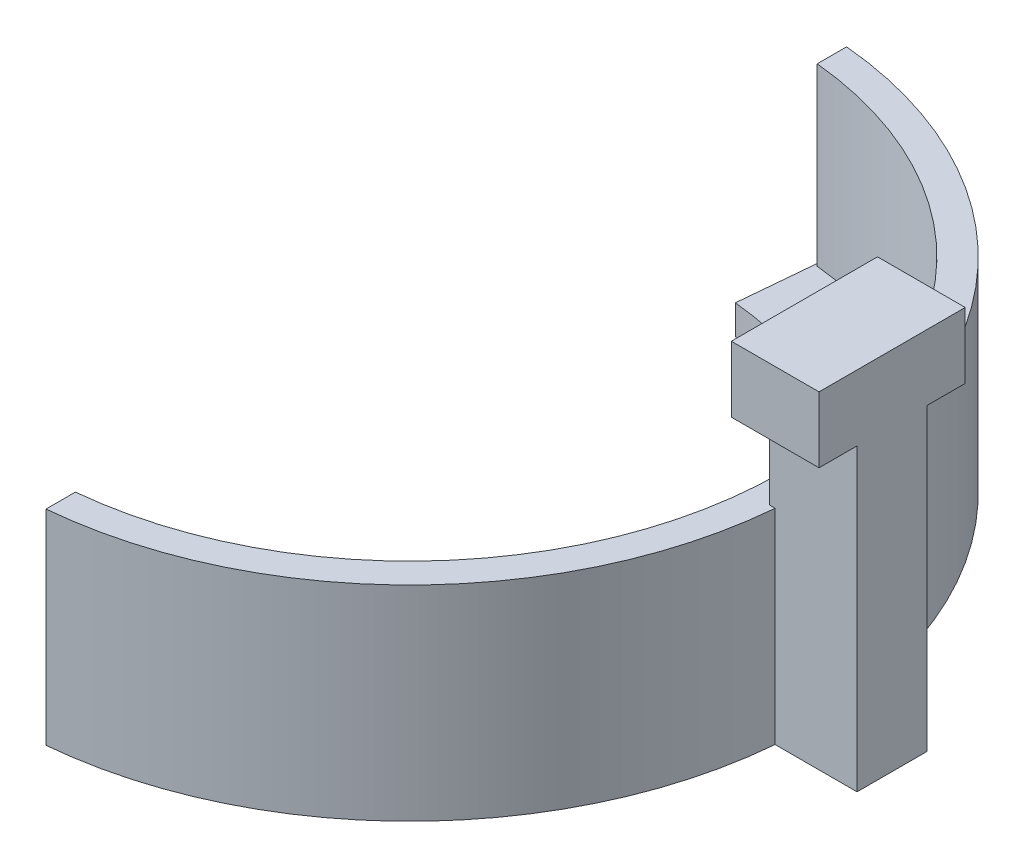
from build123d import *

# Parameters (mm, degrees)
BOSS_EXTRUDE3_DEPTH      = 12
BOSS_EXTRUDE4_START      = -2
BOSS_EXTRUDE4_DEPTH      = 2
SKETCH3_W                = 6
SKETCH3_H                = 4.8
BOSS_EXTRUDE5_DEPTH      = 22
BOSS_EXTRUDE6_DEPTH      = 3
BOSS_EXTRUDE6_DEPTH_BACK = 1.5
SKETCH4_W                = 6
SKETCH4_H                = 10


with BuildPart() as part:
    # Sketch1 → Boss-Extrude3 (new body)
    with BuildSketch(Plane(origin=(0, 0, 0), x_dir=(1, 0, 0), z_dir=(0, 1, 0))):
        with BuildLine():
            Line((2.5, 27.386127875), (2.5, 25.377155081))
            ThreePointArc((2.5, 25.377155081), (25.5, 0), (2.5, -25.377155081))
            Line((2.5, -25.377155081), (2.5, -27.386127875))
            ThreePointArc((2.5, -27.386127875), (27.5, 0), (2.5, 27.386127875))
        make_face()
    extrude(amount=BOSS_EXTRUDE3_DEPTH)

    # Sketch2 → Boss-Extrude4 (add)
    with BuildSketch(Plane(origin=(0, 0, 0), x_dir=(1, 0, 0), z_dir=(0, 1, 0)).offset(BOSS_EXTRUDE4_START)):
        with BuildLine():
            Line((2.5, 27.386127875), (1.863636364, 20.415113507))
            ThreePointArc((1.863636364, 20.415113507), (20.5, 0), (1.863636364, -20.415113507))
            Line((1.863636364, -20.415113507), (2.5, -27.386127875))
            ThreePointArc((2.5, -27.386127875), (27.5, 0), (2.5, 27.386127875))
        make_face()
    extrude(amount=BOSS_EXTRUDE4_DEPTH)

    # Sketch3 → Boss-Extrude5 (add)
    with BuildSketch(Plane.XZ.offset(2)):
        with Locations((30, 0)):
            Rectangle(SKETCH3_W, SKETCH3_H)
    extrude(amount=-BOSS_EXTRUDE5_DEPTH)

    # Sketch4 → Boss-Extrude6 (add, two sides: drawn at the far end of the back side and taken through both)
    with BuildSketch(Plane(origin=(0, 20, 0), x_dir=(1, 0, 0), z_dir=(0, 1, 0)).offset(-BOSS_EXTRUDE6_DEPTH_BACK)):
        with Locations((30, 0)):
            Rectangle(SKETCH4_W, SKETCH4_H)
    extrude(amount=BOSS_EXTRUDE6_DEPTH + BOSS_EXTRUDE6_DEPTH_BACK)


solid = part.part
